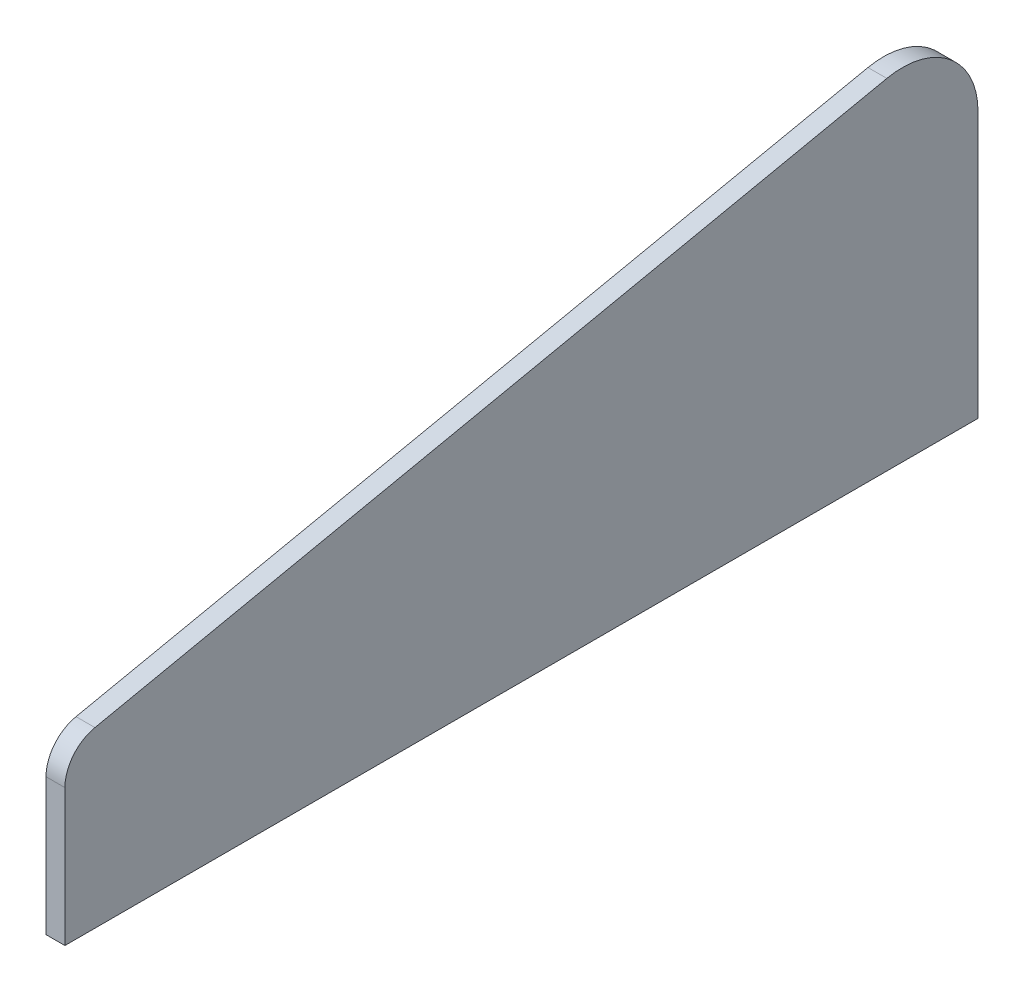
from build123d import *

# Parameters (mm, degrees)
BOSS_EXTRUDE1_DEPTH = 12.7
FILLET2_R           = 50.8
FILLET3_R           = 25.4
SKETCH2_W           = 20
SKETCH2_H           = 5
CUT_EXTRUDE1_DEPTH  = 5
SKETCH3_W           = 20
SKETCH3_H           = 5
CUT_EXTRUDE2_DEPTH  = 5


with BuildPart() as part:
    # Sketch1 → Boss-Extrude1 (new body)
    with BuildSketch(Plane(origin=(0, 0, 0), x_dir=(0, 0, -1), z_dir=(1, 0, 0))):
        Polygon((44.210163248, 18.673348758), (552.210163248, 18.673348758), (552.210163248, 259.973348758), (-61.277709779, 131.198589616), (-61.277709779, 18.673348758), align=None)
    extrude(amount=BOSS_EXTRUDE1_DEPTH)

    # Fillet2
    fillet2_edges = [part.edges().sort_by_distance(p)[0] for p in [
        (6.35, 259.973348758, -552.210163248),
    ]]
    fillet(fillet2_edges, radius=FILLET2_R)

    # Fillet3
    fillet3_edges = [part.edges().sort_by_distance(p)[0] for p in [
        (6.35, 131.198589616, 61.277709779),
    ]]
    fillet(fillet3_edges, radius=FILLET3_R)

    # Sketch2 → Cut-Extrude1 (cut)
    with BuildSketch(Plane(origin=(0, -2.351141299, -40.658116651), x_dir=(0, -0.05233595624294396, 0.998629534754574), z_dir=(-1, 0, 0))):
        with Locations((-83.722290221, 68.673348758)):
            Rectangle(SKETCH2_W, SKETCH2_H)
    extrude(amount=-CUT_EXTRUDE1_DEPTH, mode=Mode.SUBTRACT)

    # Sketch3 → Cut-Extrude2 (cut)
    with BuildSketch(Plane(origin=(0, -30.516141981, -7.826738697), x_dir=(0, -0.10452846326765375, 0.9945218953682733), z_dir=(-1, 0, 0))):
        with Locations((-330.716980881, 109.116306173)):
            Rectangle(SKETCH3_W, SKETCH3_H)
    extrude(amount=-CUT_EXTRUDE2_DEPTH, mode=Mode.SUBTRACT)


solid = part.part
